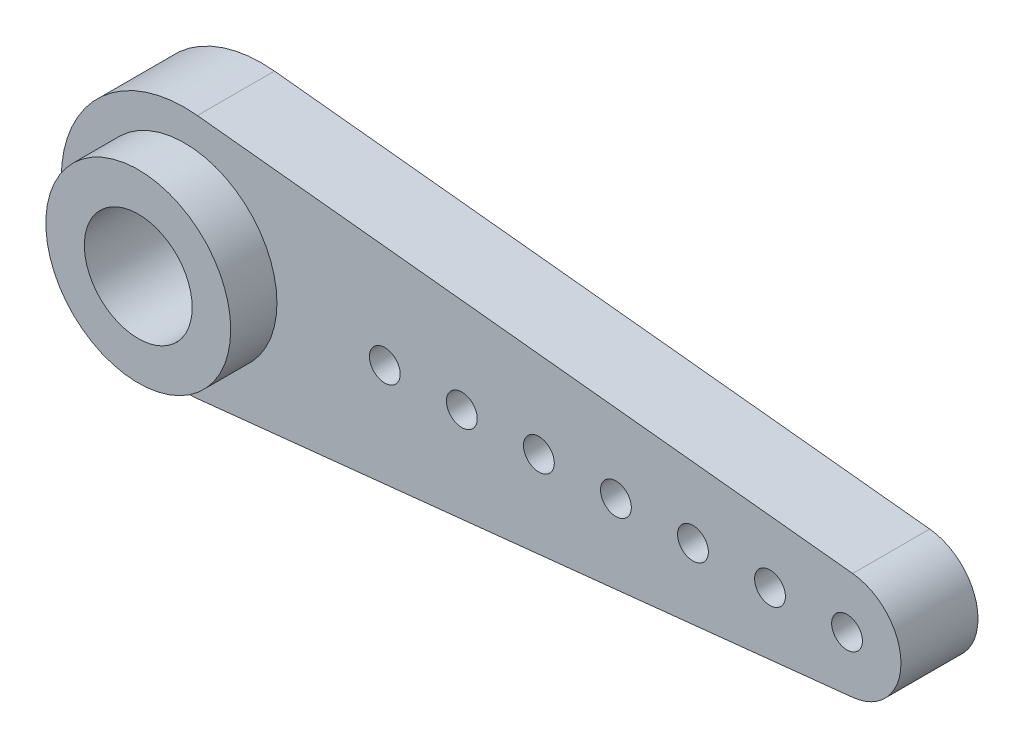
from build123d import *

# Parameters (mm, degrees)
ESQUISSE1_R             = 1
ESQUISSE1_R_2           = 1.5
BOSS_EXTRU_1_DEPTH      = 5
ESQUISSE2_R             = 6
BOSS_EXTRU_2_DEPTH      = 3
ESQUISSE3_R             = 3.5
ENL_V_MAT_EXTRU_1_DEPTH = 5


with BuildPart() as part:
    # Esquisse1 → Boss.-Extru.1 (new body)
    with BuildSketch(Plane.XY):
        with BuildLine():
            Line((0.837209302, 7.956071932), (43.36627907, 3.48078147))
            ThreePointArc((43.36627907, 3.48078147), (46.5, 0), (43.36627907, -3.48078147))
            Line((43.36627907, -3.48078147), (0.837209302, -7.956071932))
            ThreePointArc((0.837209302, -7.956071932), (-8, 0), (0.837209302, 7.956071932))
        make_face()
        with Locations((43, 0)):
            Circle(ESQUISSE1_R, mode=Mode.SUBTRACT)
        Circle(ESQUISSE1_R_2, mode=Mode.SUBTRACT)
        with Locations((38, 0)):
            Circle(ESQUISSE1_R, mode=Mode.SUBTRACT)
        with Locations((33, 0)):
            Circle(ESQUISSE1_R, mode=Mode.SUBTRACT)
        with Locations((28, 0)):
            Circle(ESQUISSE1_R, mode=Mode.SUBTRACT)
        with Locations((23, 0)):
            Circle(ESQUISSE1_R, mode=Mode.SUBTRACT)
        with Locations((18, 0)):
            Circle(ESQUISSE1_R, mode=Mode.SUBTRACT)
        with Locations((13, 0)):
            Circle(ESQUISSE1_R, mode=Mode.SUBTRACT)
    extrude(amount=BOSS_EXTRU_1_DEPTH)

    # Esquisse2 → Boss.-Extru.2 (add)
    with BuildSketch(Plane.XY.offset(5)):
        Circle(ESQUISSE2_R)
    extrude(amount=BOSS_EXTRU_2_DEPTH)

    # Esquisse3 → Enlèv. mat.-Extru.1 (cut)
    with BuildSketch(Plane.XY.offset(8)):
        Circle(ESQUISSE3_R)
    extrude(amount=-ENL_V_MAT_EXTRU_1_DEPTH, mode=Mode.SUBTRACT)


solid = part.part
